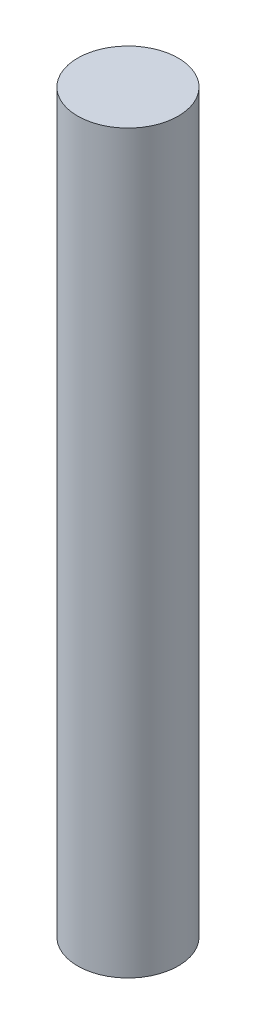
from build123d import *

# Parameters (mm, degrees)
SKETCH2_R           = 2.05
BOSS_EXTRUDE1_DEPTH = 30


with BuildPart() as part:
    # Sketch2 → Boss-Extrude1 (new body)
    with BuildSketch(Plane(origin=(0, 0, 0), x_dir=(1, 0, 0), z_dir=(0, 1, 0))):
        with Locations(Location((0, 0, 0), (0, 0, 270))):
            Circle(SKETCH2_R)
    extrude(amount=BOSS_EXTRUDE1_DEPTH)


solid = part.part
